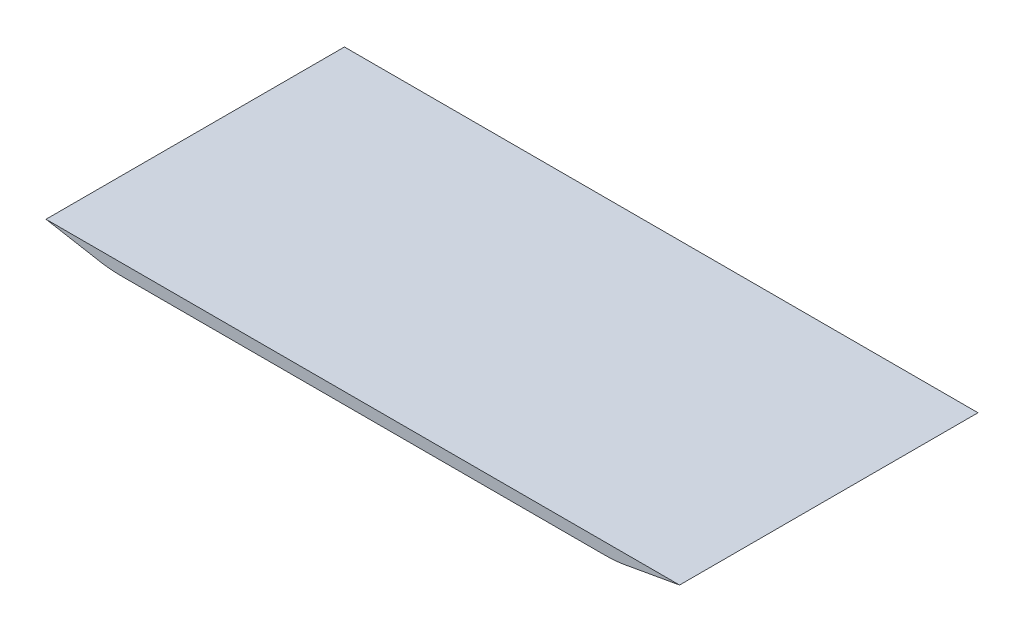
from build123d import *

# Parameters (mm, degrees)
BOSS_EXTRUDE1_DEPTH = 130
FILLET1_R           = 50


with BuildPart() as part:
    # Sketch1 → Boss-Extrude1 (new body)
    with BuildSketch(Plane.XY):
        Polygon((0, 0), (276, 0), (248, -5), (28, -5), align=None)
    extrude(amount=BOSS_EXTRUDE1_DEPTH)

    # Fillet1
    fillet1_edges = [part.edges().sort_by_distance(p)[0] for p in [
        (248, -5, 65),
        (28, -5, 65),
    ]]
    fillet(fillet1_edges, radius=FILLET1_R)


solid = part.part
